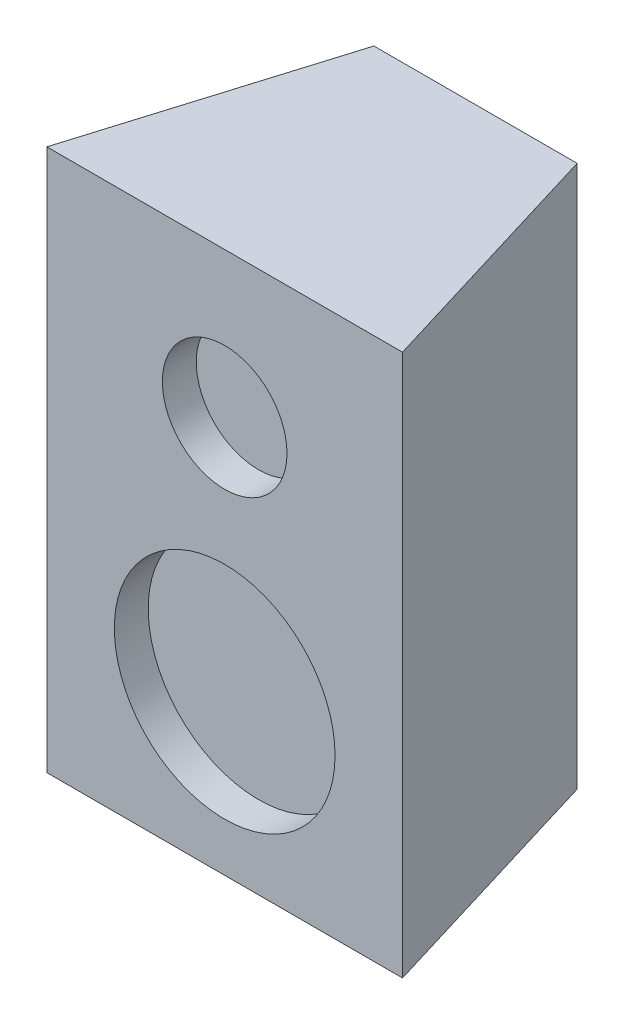
from build123d import *

# Parameters (mm, degrees)
BOSS_EXTRUDE1_DEPTH = 203.2
SKETCH2_R           = 23.365349899
SKETCH2_R_2         = 41.378531947
CUT_EXTRUDE1_DEPTH  = 12.7


with BuildPart() as part:
    # Sketch1 → Boss-Extrude1 (new body)
    with BuildSketch(Plane(origin=(0, 0, 0), x_dir=(1, 0, 0), z_dir=(0, 1, 0))):
        Polygon((-76.511565421, 0), (56.838434579, 0), (28.263434579, 94.053387857), (-47.936565421, 94.053387857), align=None)
    extrude(amount=BOSS_EXTRUDE1_DEPTH)

    # Sketch2 → Cut-Extrude1 (cut)
    with BuildSketch(Plane.XY):
        with Locations((-9.836565421, 148.691225426)):
            Circle(SKETCH2_R)
        with Locations((-9.836565421, 59.601825969)):
            Circle(SKETCH2_R_2)
    extrude(amount=-CUT_EXTRUDE1_DEPTH, mode=Mode.SUBTRACT)


solid = part.part
